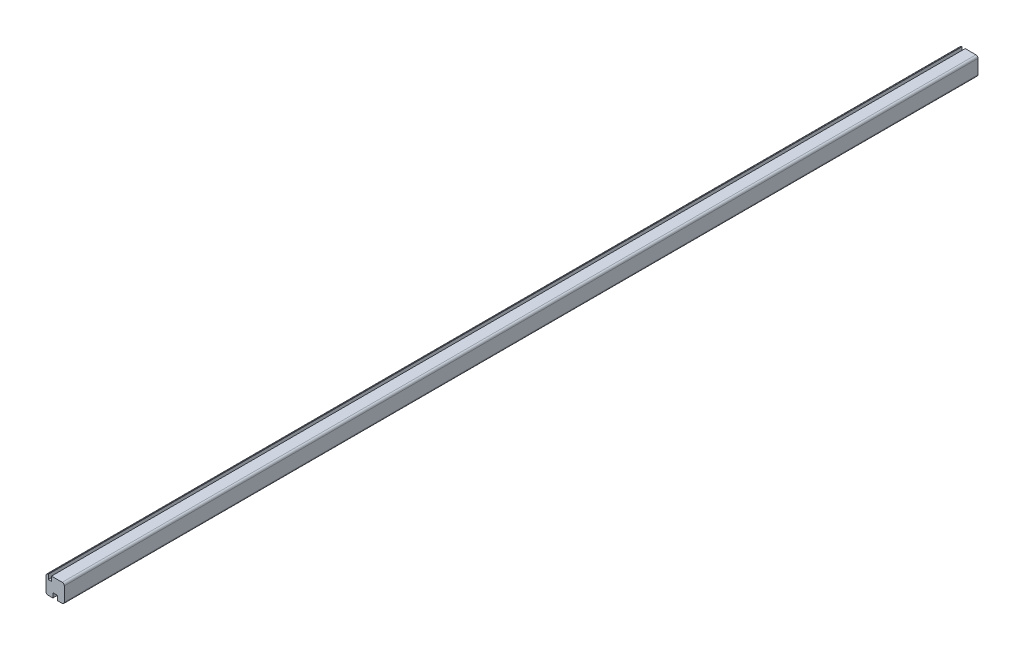
from build123d import *

# Parameters (mm, degrees)
BOSS_EXTRUDE1_DEPTH = 2000


with BuildPart() as part:
    # Sketch1 → Boss-Extrude1 (new body)
    with BuildSketch(Plane.XY):
        with BuildLine():
            Line((-15.5, -20), (-5, -20))
            Line((-5, -20), (-5, -10))
            Line((-5, -10), (5, -10))
            Line((5, -10), (5, -20))
            Line((5, -20), (15.5, -20))
            ThreePointArc((15.5, -20), (18.681980515, -18.681980515), (20, -15.5))
            Line((20, -15.5), (20, 15.5))
            ThreePointArc((20, 15.5), (18.681980515, 18.681980515), (15.5, 20))
            Line((15.5, 20), (-8, 20))
            Line((-8, 20), (-8, 10))
            Line((-8, 10), (-15, 10))
            Line((-15, 10), (-15, 20))
            Line((-15, 20), (-15.5, 20))
            ThreePointArc((-15.5, 20), (-18.681980515, 18.681980515), (-20, 15.5))
            Line((-20, 15.5), (-20, -15.5))
            ThreePointArc((-20, -15.5), (-18.681980515, -18.681980515), (-15.5, -20))
        make_face()
    extrude(amount=BOSS_EXTRUDE1_DEPTH)


solid = part.part
